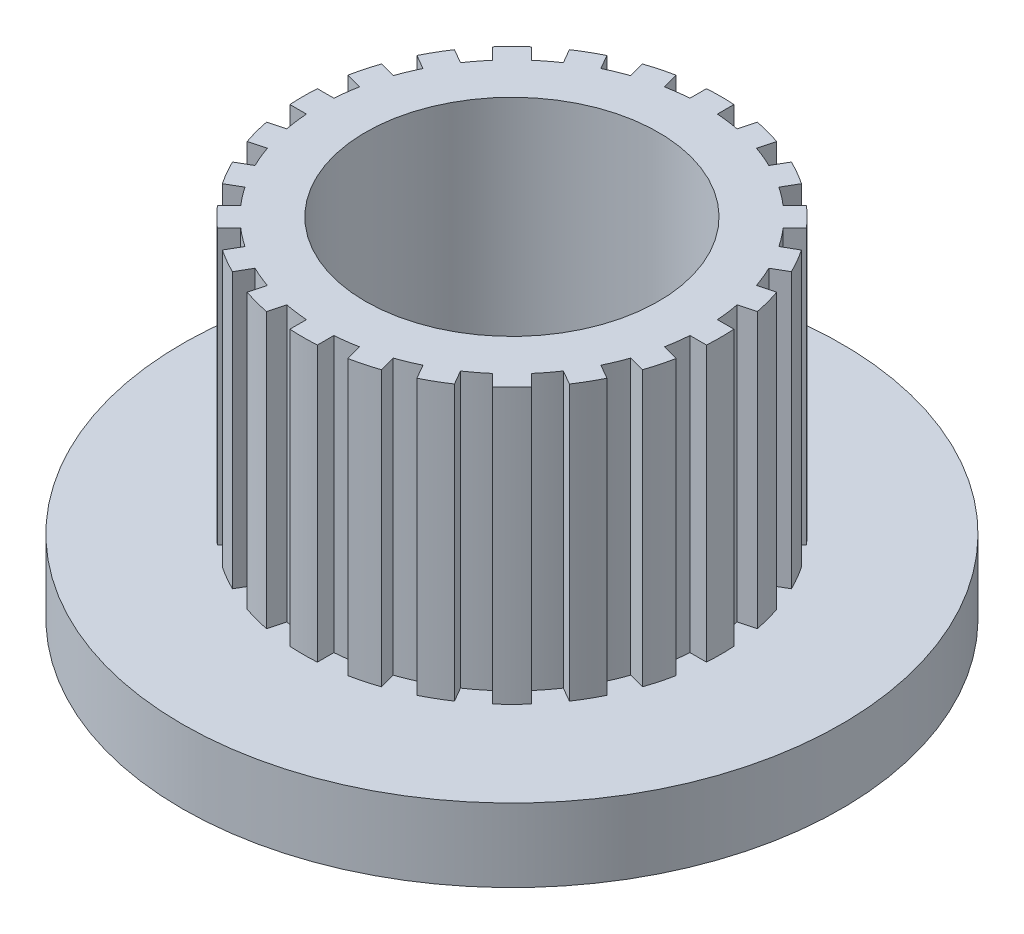
from build123d import *

# Parameters (mm, degrees)
SKETCH1_R           = 5.25
BOSS_EXTRUDE1_DEPTH = 7.5
SKETCH2_W           = 6
SKETCH2_H           = 0.75
SKETCH2_W_2         = 0.75
SKETCH2_H_2         = 6
BOSS_EXTRUDE2_DEPTH = 7.5
SKETCH5_W           = 10
SKETCH5_H           = 10
SKETCH6_R           = 9
BOSS_EXTRUDE3_DEPTH = 2
SKETCH7_R           = 4
CUT_EXTRUDE2_DEPTH  = 16.882380174


with BuildPart() as part:
    # Sketch1 → Boss-Extrude1 (new body)
    with BuildSketch(Plane(origin=(0, 0, 0), x_dir=(1, 0, 0), z_dir=(0, 1, 0))):
        with Locations(Location((0, 0, 0), (0, 0, 270))):
            Circle(SKETCH1_R)
    extrude(amount=BOSS_EXTRUDE1_DEPTH)

    # Sketch2 → Boss-Extrude2 (add)
    with BuildSketch(Plane.XZ):
        with Locations((8, 0)):
            Rectangle(SKETCH2_W, SKETCH2_H)
        Polygon((10.528126947, -3.209231681), (4.73257199, -1.65631741), (4.926686273, -0.931873041), (10.722241231, -2.484787311), align=None)
        Polygon((9.338779442, -5.824759526), (4.142627019, -2.824759526), (4.517627019, -2.175240474), (9.713779442, -5.175240474), align=None)
        Polygon((7.51300955, -8.043339636), (3.270368863, -3.800698949), (3.800698949, -3.270368863), (8.043339636, -7.51300955), align=None)
        Polygon((5.175240474, -9.713779442), (2.175240474, -4.517627019), (2.824759526, -4.142627019), (5.824759526, -9.338779442), align=None)
        Polygon((2.484787311, -10.722241231), (0.931873041, -4.926686273), (1.65631741, -4.73257199), (3.209231681, -10.528126947), align=None)
        with Locations((0, -8)):
            Rectangle(SKETCH2_W_2, SKETCH2_H_2)
        Polygon((-3.209231681, -10.528126947), (-1.65631741, -4.73257199), (-0.931873041, -4.926686273), (-2.484787311, -10.722241231), align=None)
        Polygon((-5.824759526, -9.338779442), (-2.824759526, -4.142627019), (-2.175240474, -4.517627019), (-5.175240474, -9.713779442), align=None)
        Polygon((-8.043339636, -7.51300955), (-3.800698949, -3.270368863), (-3.270368863, -3.800698949), (-7.51300955, -8.043339636), align=None)
        Polygon((-9.713779442, -5.175240474), (-4.517627019, -2.175240474), (-4.142627019, -2.824759526), (-9.338779442, -5.824759526), align=None)
        Polygon((-10.722241231, -2.484787311), (-4.926686273, -0.931873041), (-4.73257199, -1.65631741), (-10.528126947, -3.209231681), align=None)
        with Locations((-8, 0)):
            Rectangle(SKETCH2_W, SKETCH2_H)
        Polygon((-10.528126947, 3.209231681), (-4.73257199, 1.65631741), (-4.926686273, 0.931873041), (-10.722241231, 2.484787311), align=None)
        Polygon((-9.338779442, 5.824759526), (-4.142627019, 2.824759526), (-4.517627019, 2.175240474), (-9.713779442, 5.175240474), align=None)
        Polygon((-7.51300955, 8.043339636), (-3.270368863, 3.800698949), (-3.800698949, 3.270368863), (-8.043339636, 7.51300955), align=None)
        Polygon((-5.175240474, 9.713779442), (-2.175240474, 4.517627019), (-2.824759526, 4.142627019), (-5.824759526, 9.338779442), align=None)
        Polygon((-2.484787311, 10.722241231), (-0.931873041, 4.926686273), (-1.65631741, 4.73257199), (-3.209231681, 10.528126947), align=None)
        with Locations((0, 8)):
            Rectangle(SKETCH2_W_2, SKETCH2_H_2)
        Polygon((3.209231681, 10.528126947), (1.65631741, 4.73257199), (0.931873041, 4.926686273), (2.484787311, 10.722241231), align=None)
        Polygon((5.824759526, 9.338779442), (2.824759526, 4.142627019), (2.175240474, 4.517627019), (5.175240474, 9.713779442), align=None)
        Polygon((8.043339636, 7.51300955), (3.800698949, 3.270368863), (3.270368863, 3.800698949), (7.51300955, 8.043339636), align=None)
        Polygon((9.713779442, 5.175240474), (4.517627019, 2.175240474), (4.142627019, 2.824759526), (9.338779442, 5.824759526), align=None)
        Polygon((10.722241231, 2.484787311), (4.926686273, 0.931873041), (4.73257199, 1.65631741), (10.528126947, 3.209231681), align=None)
    extrude(amount=-BOSS_EXTRUDE2_DEPTH)

    # Sketch5 → Cut-Revolve1 (revolve, cut)
    with BuildSketch(Plane(origin=(0, 0, 0), x_dir=(0, 0, -1), z_dir=(1, 0, 0))):
        with Locations((10.7, 4)):
            Rectangle(SKETCH5_W, SKETCH5_H)
    revolve(axis=Axis((0, 0, 0), (0, 1, 0)), mode=Mode.SUBTRACT)

    # Sketch6 → Boss-Extrude3 (add)
    with BuildSketch(Plane(origin=(0, 0, 0), x_dir=(1, 0, 0), z_dir=(0, 1, 0))):
        with Locations(Location((0, 0, 0), (0, 0, 270))):
            Circle(SKETCH6_R)
    extrude(amount=-BOSS_EXTRUDE3_DEPTH)

    # Sketch7 → Cut-Extrude2 (cut, through all)
    with BuildSketch(Plane(origin=(0, 7.5, 0), x_dir=(1, 0, 0), z_dir=(0, 1, 0))):
        with Locations(Location((0, 0, 0), (0, 0, 270))):
            Circle(SKETCH7_R)
    extrude(amount=-CUT_EXTRUDE2_DEPTH, mode=Mode.SUBTRACT)


solid = part.part
